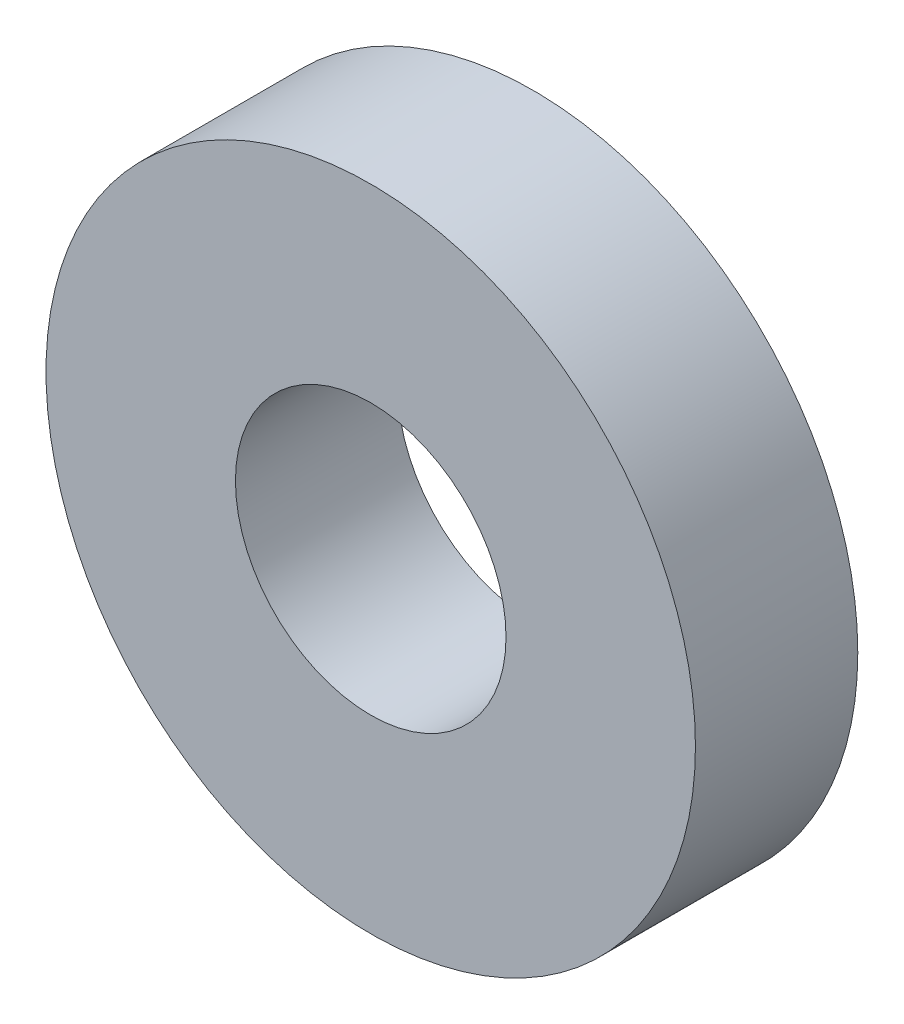
from build123d import *

# Parameters (mm, degrees)
SKETCH_8_R      = 60
SKETCH_8_R_2    = 25
EXTRUDE_1_DEPTH = 30


with BuildPart() as part:
    # 草图8 → 凸台-拉伸1 (new body)
    with BuildSketch(Plane.XY):
        Circle(SKETCH_8_R)
        Circle(SKETCH_8_R_2, mode=Mode.SUBTRACT)
    extrude(amount=EXTRUDE_1_DEPTH)


solid = part.part
